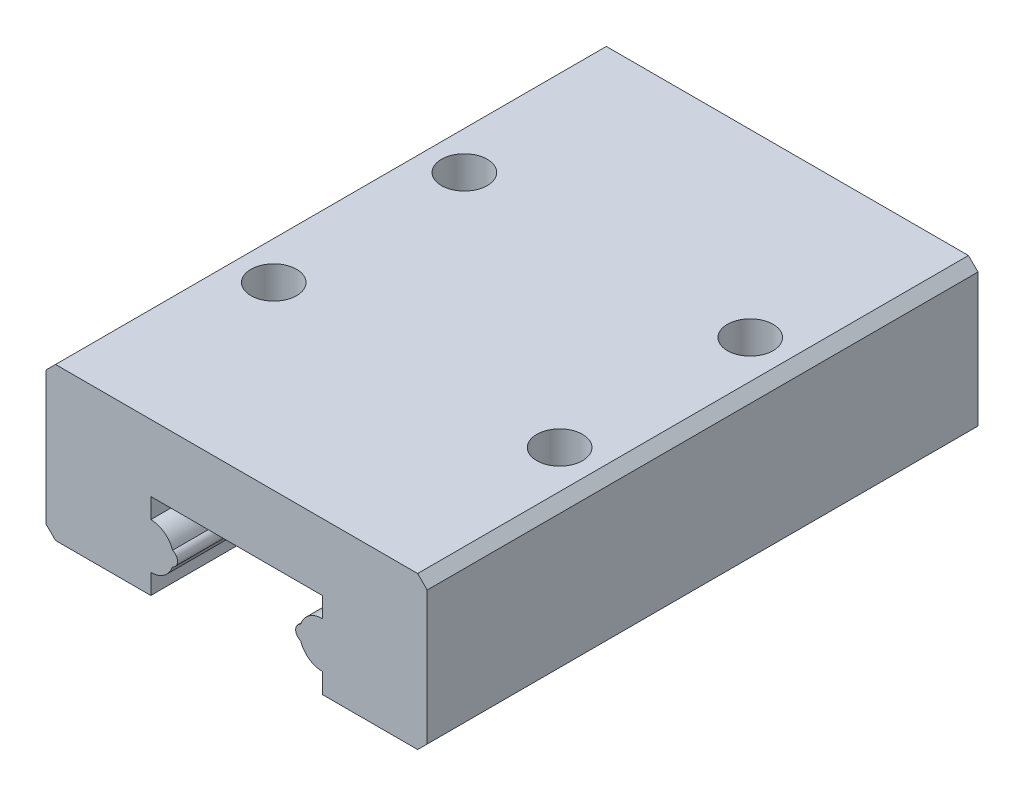
from build123d import *

# Parameters (mm, degrees)
EXTRUDE_1_DEPTH     = 28.9
SKETCH_2_R          = 1.2
CUT_EXTRUDE_1_DEPTH = 5


with BuildPart() as part:
    # 草图1 → 凸台-拉伸1 (new body)
    with BuildSketch(Plane.XY):
        with BuildLine():
            Line((-19.5, 8), (-20, 7.5))
            Line((-20, 7.5), (-20, 0.5))
            Line((-20, 0.5), (-19.5, 0))
            Line((-19.5, 0), (-14.5, 0))
            Line((-14.5, 0), (-14.5, 1.05))
            ThreePointArc((-14.5, 1.05), (-13.796309676, 1.277981519), (-13.36, 1.87530012))
            ThreePointArc((-13.36, 1.87530012), (-13.1, 2.25), (-13.36, 2.62469988))
            ThreePointArc((-13.36, 2.62469988), (-13.796309676, 3.222018481), (-14.5, 3.45))
            Line((-14.5, 3.45), (-14.5, 4.5))
            Line((-14.5, 4.5), (-5.5, 4.5))
            Line((-5.5, 4.5), (-5.5, 3.45))
            ThreePointArc((-5.5, 3.45), (-6.203690324, 3.222018481), (-6.64, 2.62469988))
            ThreePointArc((-6.64, 2.62469988), (-6.9, 2.25), (-6.64, 1.87530012))
            ThreePointArc((-6.64, 1.87530012), (-6.203690324, 1.277981519), (-5.5, 1.05))
            Line((-5.5, 1.05), (-5.5, 0))
            Line((-5.5, 0), (-0.5, 0))
            Line((-0.5, 0), (0, 0.5))
            Line((0, 0.5), (0, 7.5))
            Line((0, 7.5), (-0.5, 8))
            Line((-0.5, 8), (-19.5, 8))
        make_face()
    extrude(amount=-EXTRUDE_1_DEPTH)

    # 草图2 → 切除-拉伸1 (cut)
    with BuildSketch(Plane(origin=(0, 8, 0), x_dir=(1, 0, 0), z_dir=(0, 1, 0))):
        with Locations(Location((-17.5, 19.45, 0), (0, 0, 180))):
            Circle(SKETCH_2_R)
        with Locations(Location((-2.5, 19.45, 0), (0, 0, 180))):
            Circle(SKETCH_2_R)
        with Locations(Location((-2.5, 9.45, 0), (0, 0, 180))):
            Circle(SKETCH_2_R)
        with Locations(Location((-17.5, 9.45, 0), (0, 0, 180))):
            Circle(SKETCH_2_R)
    extrude(amount=-CUT_EXTRUDE_1_DEPTH, mode=Mode.SUBTRACT)


solid = part.part
